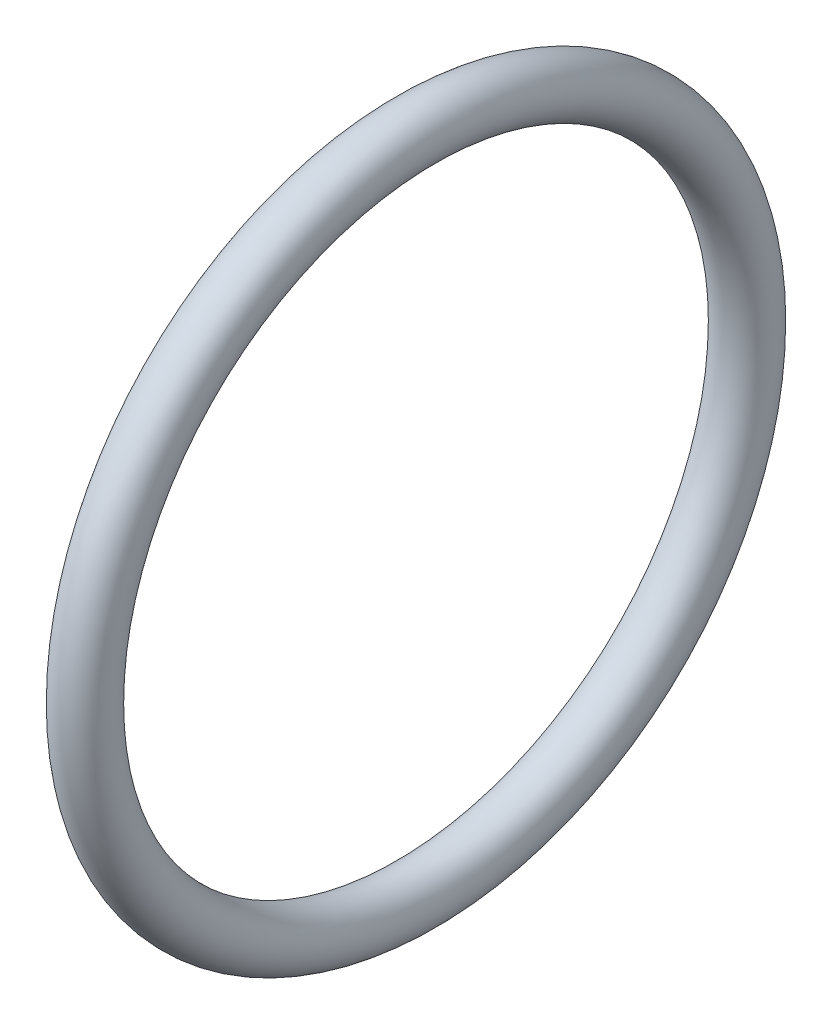
from build123d import *

# Parameters (mm, degrees)
SKETCH_1_R = 1.55


with BuildPart() as part:
    # 草图1 → 旋转1 (revolve)
    with BuildSketch(Plane.XY, mode=Mode.PRIVATE) as revolve_1_sk:
        with Locations((0, 18.75)):
            Circle(SKETCH_1_R)
    revolve(revolve_1_sk.sketch.rotate(Axis((0, 0, 0), (1, 0, 0)), 90), axis=Axis((0, 0, 0), (1, 0, 0)))


solid = part.part
